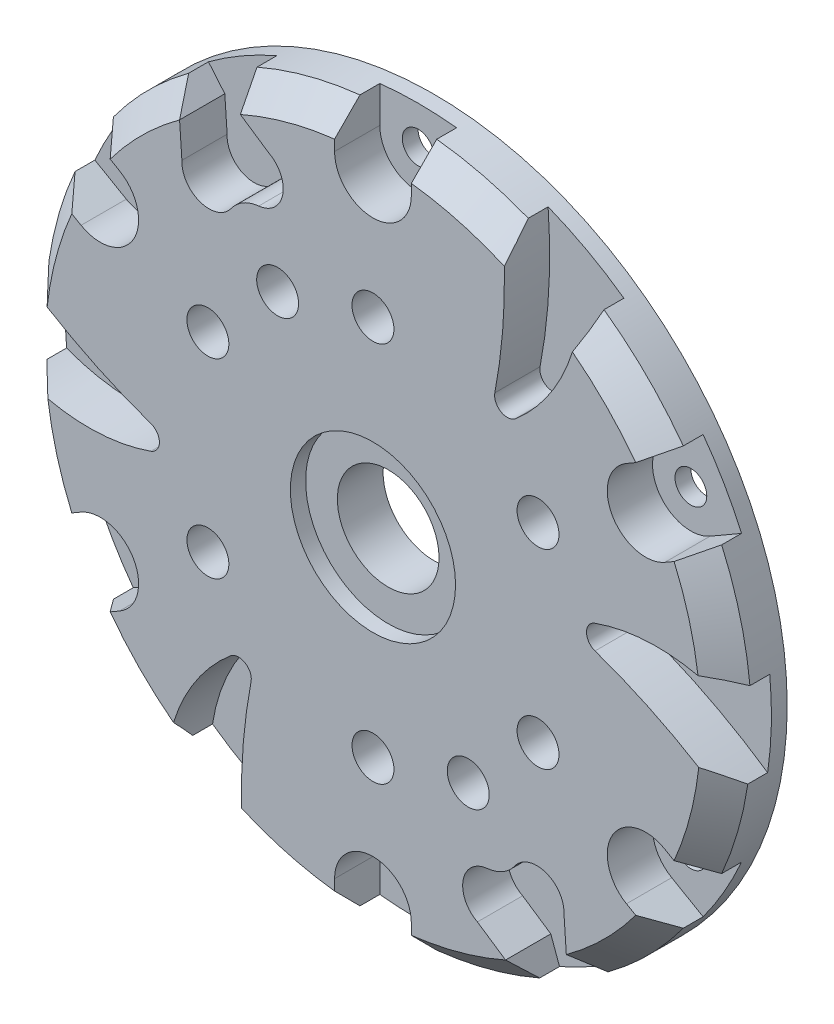
from build123d import *

# Parameters (mm, degrees)
SKETCH1_R             = 27.8
BOSS_EXTRUDE1_DEPTH   = 4.8
CHAMFER1_SIZE         = 2
CUT_EXTRUDE1_START    = -3.56
CUT_EXTRUDE1_DEPTH    = 3.56
M4X0_7_TAPPED_HOLE1_D = 3.3
SKETCH7_R             = 4
CUT_EXTRUDE2_DEPTH    = 40.607070076
SKETCH8_R             = 6.5
CUT_EXTRUDE3_DEPTH    = 1.2
M3X0_5_TAPPED_HOLE2_D = 2.5


with BuildPart() as part:
    # Sketch1 → Boss-Extrude1 (new body)
    with BuildSketch(Plane.XY):
        Circle(SKETCH1_R)
    extrude(amount=BOSS_EXTRUDE1_DEPTH)

    # Chamfer1
    chamfer1_edges = [part.edges().sort_by_distance(p)[0] for p in [
        (-27.8, 0, 4.8),
    ]]
    chamfer(chamfer1_edges, length=CHAMFER1_SIZE)

    # Sketch2 → Cut-Extrude1 (cut)
    with BuildSketch(Plane.XY.offset(4.8).offset(CUT_EXTRUDE1_START)):
        with BuildLine():
            Line((-3.02, 27.635477199), (-3.02, 24.78))
            ThreePointArc((-3.02, 24.78), (0, 21.76), (3.02, 24.78))
            Line((3.02, 24.78), (3.02, 27.635477199))
            ThreePointArc((3.02, 27.635477199), (0, 27.8), (-3.02, 27.635477199))
        make_face()
        with BuildLine():
            Line((22.4230253, 16.433135319), (19.950109506, 15.005396719))
            ThreePointArc((19.950109506, 15.005396719), (18.844712786, 10.88), (22.970109506, 9.774603281))
            Line((22.970109506, 9.774603281), (25.4430253, 11.20234188))
            ThreePointArc((25.4430253, 11.20234188), (24.075506225, 13.9), (22.4230253, 16.433135319))
        make_face()
        with BuildLine():
            Line((25.4430253, -11.20234188), (22.970109506, -9.774603281))
            ThreePointArc((22.970109506, -9.774603281), (18.844712786, -10.88), (19.950109506, -15.005396719))
            Line((19.950109506, -15.005396719), (22.4230253, -16.433135319))
            ThreePointArc((22.4230253, -16.433135319), (24.075506225, -13.9), (25.4430253, -11.20234188))
        make_face()
        with BuildLine():
            Line((3.02, -27.635477199), (3.02, -24.78))
            ThreePointArc((3.02, -24.78), (0, -21.76), (-3.02, -24.78))
            Line((-3.02, -24.78), (-3.02, -27.635477199))
            ThreePointArc((-3.02, -27.635477199), (0, -27.8), (3.02, -27.635477199))
        make_face()
        with BuildLine():
            Line((-22.4230253, -16.433135319), (-19.950109506, -15.005396719))
            ThreePointArc((-19.950109506, -15.005396719), (-18.844712786, -10.88), (-22.970109506, -9.774603281))
            Line((-22.970109506, -9.774603281), (-25.4430253, -11.20234188))
            ThreePointArc((-25.4430253, -11.20234188), (-24.075506225, -13.9), (-22.4230253, -16.433135319))
        make_face()
        with BuildLine():
            Line((-25.4430253, 11.20234188), (-22.970109506, 9.774603281))
            ThreePointArc((-22.970109506, 9.774603281), (-18.844712786, 10.88), (-19.950109506, 15.005396719))
            Line((-19.950109506, 15.005396719), (-22.4230253, 16.433135319))
            ThreePointArc((-22.4230253, 16.433135319), (-24.075506225, 13.9), (-25.4430253, 11.20234188))
        make_face()
        with BuildLine():
            ThreePointArc((-8.990760958, 18.077325331), (-7.097001538, 19.802867047), (-8.218352654, 22.106427471))
            Line((-8.218352654, 22.106427471), (-10.434772365, 23.595667519))
            Line((-10.434772365, 23.595667519), (-11.326579695, 26.037938541))
            ThreePointArc((-11.326579695, 26.037938541), (-14.197408663, 24.590633141), (-16.886226391, 22.828075024))
            Line((-16.886226391, 22.828075024), (-15.217061308, 20.834611711))
            Line((-15.217061308, 20.834611711), (-15.035551449, 18.170515911))
            ThreePointArc((-15.035551449, 18.170515911), (-13.601285161, 16.047617146), (-11.16004249, 16.824890055))
            ThreePointArc((-11.16004249, 16.824890055), (-10.211194098, 17.686306984), (-8.990760958, 18.077325331))
        make_face()
        with BuildLine():
            ThreePointArc((8.990760958, -18.077325331), (7.097001538, -19.802867047), (8.218352654, -22.106427471))
            Line((8.218352654, -22.106427471), (10.434772365, -23.595667519))
            Line((10.434772365, -23.595667519), (11.326579695, -26.037938541))
            ThreePointArc((11.326579695, -26.037938541), (14.197408663, -24.590633141), (16.886226391, -22.828075024))
            Line((16.886226391, -22.828075024), (15.217061308, -20.834611711))
            Line((15.217061308, -20.834611711), (15.035551449, -18.170515911))
            ThreePointArc((15.035551449, -18.170515911), (13.601285161, -16.047617146), (11.16004249, -16.824890055))
            ThreePointArc((11.16004249, -16.824890055), (10.211194098, -17.686306984), (8.990760958, -18.077325331))
        make_face()
        with BuildLine():
            ThreePointArc((9.592925481, 14.639879042), (10.072666849, 13.587453118), (11.224576406, 13.691647537))
            ThreePointArc((11.224576406, 13.691647537), (14.666706062, 17.996812228), (16.27190214, 23.26995599))
            ThreePointArc((16.27190214, 23.26995599), (13.319162757, 25.077191918), (10.168440088, 26.511666813))
            ThreePointArc((10.168440088, 26.511666813), (10.298392669, 20.555523396), (9.592925481, 14.639879042))
        make_face()
        with BuildLine():
            ThreePointArc((28.288324102, 2.456902626), (22.919049608, 3.703333926), (17.46960279, 2.874944546))
            ThreePointArc((17.46960279, 2.874944546), (16.803412997, 1.929458816), (17.474969899, 0.987777643))
            ThreePointArc((17.474969899, 0.987777643), (22.950801784, -1.359092028), (28.043997001, -4.449705973))
            ThreePointArc((28.043997001, -4.449705973), (28.377066635, -1.003862654), (28.288324102, 2.456902626))
        make_face()
        with BuildLine():
            ThreePointArc((-28.288324102, -2.456902626), (-22.919049608, -3.703333926), (-17.46960279, -2.874944546))
            ThreePointArc((-17.46960279, -2.874944546), (-16.803412997, -1.929458816), (-17.474969899, -0.987777643))
            ThreePointArc((-17.474969899, -0.987777643), (-22.950801784, 1.359092028), (-28.043997001, 4.449705973))
            ThreePointArc((-28.043997001, 4.449705973), (-28.377066635, 1.003862654), (-28.288324102, -2.456902626))
        make_face()
        with BuildLine():
            ThreePointArc((-10.168440088, -26.511666813), (-10.298392669, -20.555523396), (-9.592925481, -14.639879042))
            ThreePointArc((-9.592925481, -14.639879042), (-10.072666849, -13.587453118), (-11.224576406, -13.691647537))
            ThreePointArc((-11.224576406, -13.691647537), (-14.666706062, -17.996812228), (-16.27190214, -23.26995599))
            ThreePointArc((-16.27190214, -23.26995599), (-13.319162757, -25.077191918), (-10.168440088, -26.511666813))
        make_face()
    extrude(amount=CUT_EXTRUDE1_DEPTH, mode=Mode.SUBTRACT)

    # M4x0.7 Tapped Hole1 (through all)
    with Locations(Plane.XY.offset(4.8)):
        with Locations((0, 15), (12.990881057, 7.500866025), (12.991881057, -7.499133975), (7.501866025, -12.989881057), (0.002, -15), (-12.988881057, -7.500866025), (-12.989881057, 7.499133975), (-7.499866025, 12.989881057)):
            Hole(M4X0_7_TAPPED_HOLE1_D / 2)

    # Sketch7 → Cut-Extrude2 (cut, through all)
    with BuildSketch(Plane.XY.offset(4.8)):
        Circle(SKETCH7_R)
    extrude(amount=-CUT_EXTRUDE2_DEPTH, mode=Mode.SUBTRACT)

    # Sketch8 → Cut-Extrude3 (cut)
    with BuildSketch(Plane.XY.offset(4.8)):
        Circle(SKETCH8_R)
    extrude(amount=-CUT_EXTRUDE3_DEPTH, mode=Mode.SUBTRACT)

    # M3x0.5 Tapped Hole2 (through all)
    with Locations(Plane.XY.offset(4.8)):
        with Locations((0, 24.78), (21.460109506, 12.39), (21.460109506, -12.39), (0, -24.78), (-21.460109506, -12.39), (-21.460109506, 12.39), (0, 0)):
            Hole(M3X0_5_TAPPED_HOLE2_D / 2)


solid = part.part
